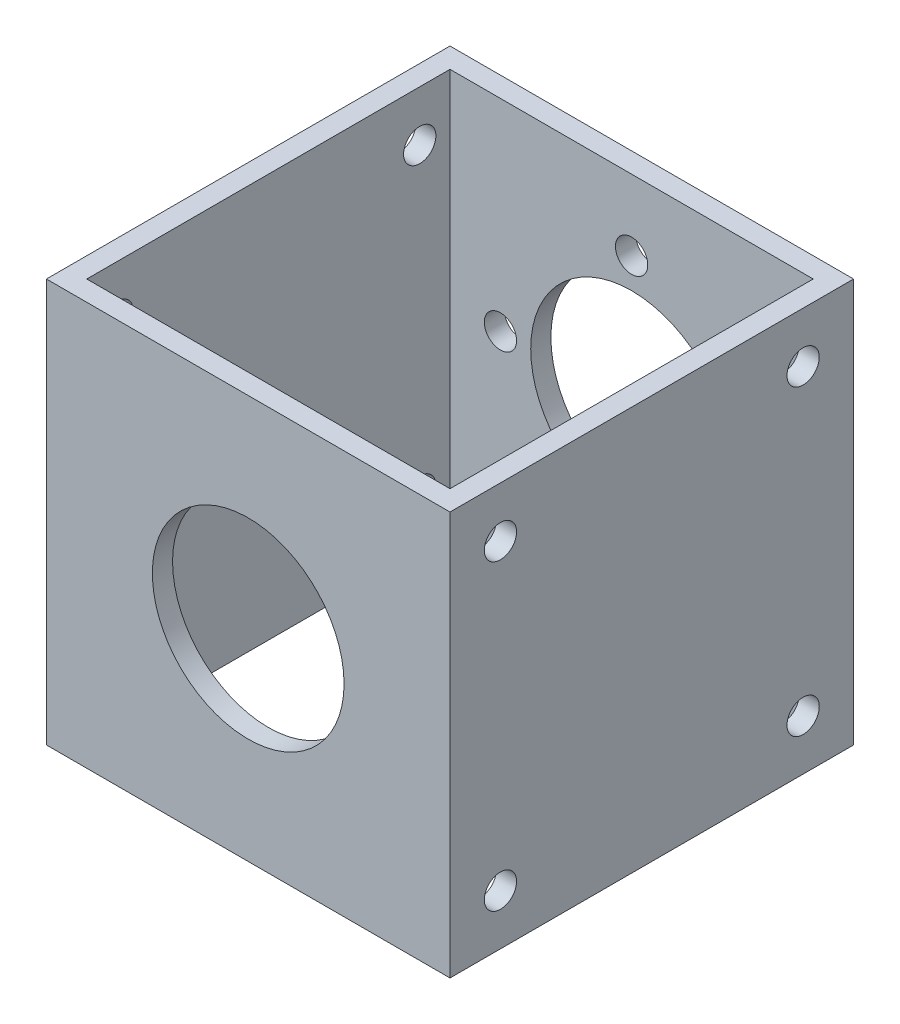
from build123d import *

# Parameters (mm, degrees)
SKETCH_1_W          = 40
SKETCH_1_H          = 40
SKETCH_1_W_2        = 36
SKETCH_1_H_2        = 36
EXTRUDE_1_DEPTH     = 40
CUT_EXTRUDE_1_REACH = 62
SKETCH_2_R          = 10
SKETCH_2_R_2        = 1.6
CUT_EXTRUDE_2_REACH = 62
SKETCH_3_R          = 9.5
SKETCH_4_R          = 1.6
CUT_EXTRUDE_3_DEPTH = 61


with BuildPart() as part:
    # ｽｹｯﾁ1 → ﾎﾞｽ - 押し出し1 (new body)
    with BuildSketch(Plane(origin=(0, 0, 0), x_dir=(1, 0, 0), z_dir=(0, 1, 0))):
        Rectangle(SKETCH_1_W, SKETCH_1_H)
        Rectangle(SKETCH_1_W_2, SKETCH_1_H_2, mode=Mode.SUBTRACT)
    extrude(amount=EXTRUDE_1_DEPTH)

    # ｽｹｯﾁ2 → ｶｯﾄ - 押し出し1 (cut, up to next)
    with BuildSketch(Plane(origin=(0, 0, -20), x_dir=(-1, 0, 0), z_dir=(0, 0, -1)), mode=Mode.PRIVATE) as cut_extrude_1_sk1:
        with Locations((0, 20)):
            Circle(SKETCH_2_R)
    cut_extrude_1_tool1 = extrude(cut_extrude_1_sk1.sketch, amount=-CUT_EXTRUDE_1_REACH, mode=Mode.PRIVATE) & part.part
    # ｽｹｯﾁ2 → ｶｯﾄ - 押し出し1 (cut, up to next)
    with BuildSketch(Plane(origin=(0, 0, -20), x_dir=(-1, 0, 0), z_dir=(0, 0, -1)), mode=Mode.PRIVATE) as cut_extrude_1_sk2:
        with Locations((0, 33)):
            Circle(SKETCH_2_R_2)
    cut_extrude_1_tool2 = extrude(cut_extrude_1_sk2.sketch, amount=-CUT_EXTRUDE_1_REACH, mode=Mode.PRIVATE) & part.part
    # ｽｹｯﾁ2 → ｶｯﾄ - 押し出し1 (cut, up to next)
    with BuildSketch(Plane(origin=(0, 0, -20), x_dir=(-1, 0, 0), z_dir=(0, 0, -1)), mode=Mode.PRIVATE) as cut_extrude_1_sk3:
        with Locations((13, 20)):
            Circle(SKETCH_2_R_2)
    cut_extrude_1_tool3 = extrude(cut_extrude_1_sk3.sketch, amount=-CUT_EXTRUDE_1_REACH, mode=Mode.PRIVATE) & part.part
    # ｽｹｯﾁ2 → ｶｯﾄ - 押し出し1 (cut, up to next)
    with BuildSketch(Plane(origin=(0, 0, -20), x_dir=(-1, 0, 0), z_dir=(0, 0, -1)), mode=Mode.PRIVATE) as cut_extrude_1_sk4:
        with Locations((0, 7)):
            Circle(SKETCH_2_R_2)
    cut_extrude_1_tool4 = extrude(cut_extrude_1_sk4.sketch, amount=-CUT_EXTRUDE_1_REACH, mode=Mode.PRIVATE) & part.part
    # ｽｹｯﾁ2 → ｶｯﾄ - 押し出し1 (cut, up to next)
    with BuildSketch(Plane(origin=(0, 0, -20), x_dir=(-1, 0, 0), z_dir=(0, 0, -1)), mode=Mode.PRIVATE) as cut_extrude_1_sk5:
        with Locations((-13, 20)):
            Circle(SKETCH_2_R_2)
    cut_extrude_1_tool5 = extrude(cut_extrude_1_sk5.sketch, amount=-CUT_EXTRUDE_1_REACH, mode=Mode.PRIVATE) & part.part
    add(cut_extrude_1_tool1.solids().sort_by_distance((0, 20, -20))[0], mode=Mode.SUBTRACT)
    add(cut_extrude_1_tool2.solids().sort_by_distance((0, 33, -20))[0], mode=Mode.SUBTRACT)
    add(cut_extrude_1_tool3.solids().sort_by_distance((-13, 20, -20))[0], mode=Mode.SUBTRACT)
    add(cut_extrude_1_tool4.solids().sort_by_distance((0, 7, -20))[0], mode=Mode.SUBTRACT)
    add(cut_extrude_1_tool5.solids().sort_by_distance((13, 20, -20))[0], mode=Mode.SUBTRACT)

    # ｽｹｯﾁ3 → ｶｯﾄ - 押し出し2 (cut, up to next)
    with BuildSketch(Plane.XY.offset(20), mode=Mode.PRIVATE) as cut_extrude_2_sk1:
        with Locations((0, 20)):
            Circle(SKETCH_3_R)
    cut_extrude_2_tool1 = extrude(cut_extrude_2_sk1.sketch, amount=-CUT_EXTRUDE_2_REACH, mode=Mode.PRIVATE) & part.part
    add(cut_extrude_2_tool1.solids().sort_by_distance((0, 20, 20))[0], mode=Mode.SUBTRACT)

    # ｽｹｯﾁ4 → ｶｯﾄ - 押し出し3 (cut, through all)
    with BuildSketch(Plane.ZY.offset(20)):
        with Locations((15, 5)):
            Circle(SKETCH_4_R)
        with Locations((-15, 5)):
            Circle(SKETCH_4_R)
        with Locations((15, 35)):
            Circle(SKETCH_4_R)
        with Locations((-15, 35)):
            Circle(SKETCH_4_R)
    extrude(amount=-CUT_EXTRUDE_3_DEPTH, mode=Mode.SUBTRACT)


solid = part.part
